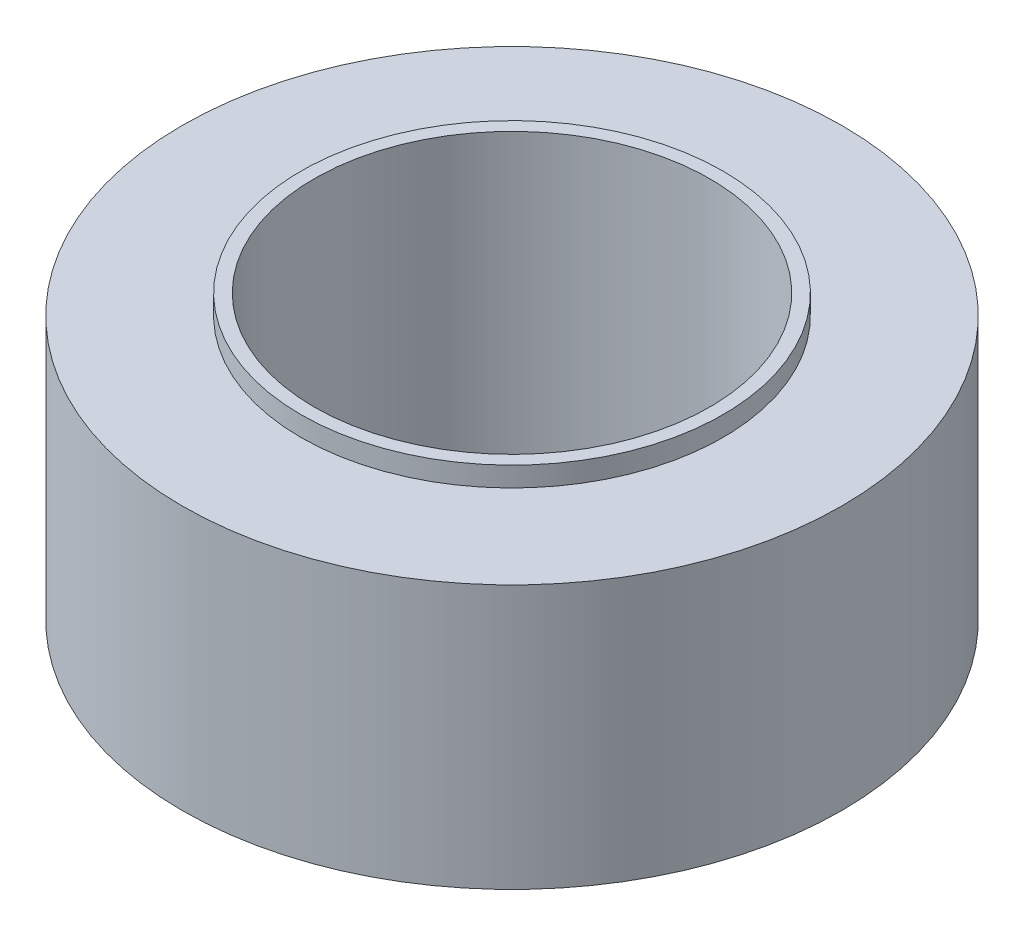
from build123d import *

# Parameters (mm, degrees)
SKETCH1_R           = 12.5
SKETCH1_R_2         = 7.5
BOSS_EXTRUDE2_DEPTH = 10
BOSS_EXTRUDE3_START = 0.75
SKETCH2_R           = 8
SKETCH2_R_2         = 7.5
BOSS_EXTRUDE3_DEPTH = 0.75


with BuildPart() as part:
    # Sketch1 → Boss-Extrude2 (new body)
    with BuildSketch(Plane(origin=(0, 0, 0), x_dir=(1, 0, 0), z_dir=(0, 1, 0))):
        with Locations(Location((0, 0, 0), (0, 0, 270))):
            Circle(SKETCH1_R)
        with Locations(Location((0, 0, 0), (0, 0, 270))):
            Circle(SKETCH1_R_2, mode=Mode.SUBTRACT)
    extrude(amount=-BOSS_EXTRUDE2_DEPTH)

    # Sketch2 → Boss-Extrude3 (add)
    with BuildSketch(Plane(origin=(0, 0, 0), x_dir=(1, 0, 0), z_dir=(0, 1, 0)).offset(BOSS_EXTRUDE3_START)):
        with Locations(Location((0, 0, 0), (0, 0, 270))):
            Circle(SKETCH2_R)
        with Locations(Location((0, 0, 0), (0, 0, 270))):
            Circle(SKETCH2_R_2, mode=Mode.SUBTRACT)
    extrude(amount=-BOSS_EXTRUDE3_DEPTH)


solid = part.part
